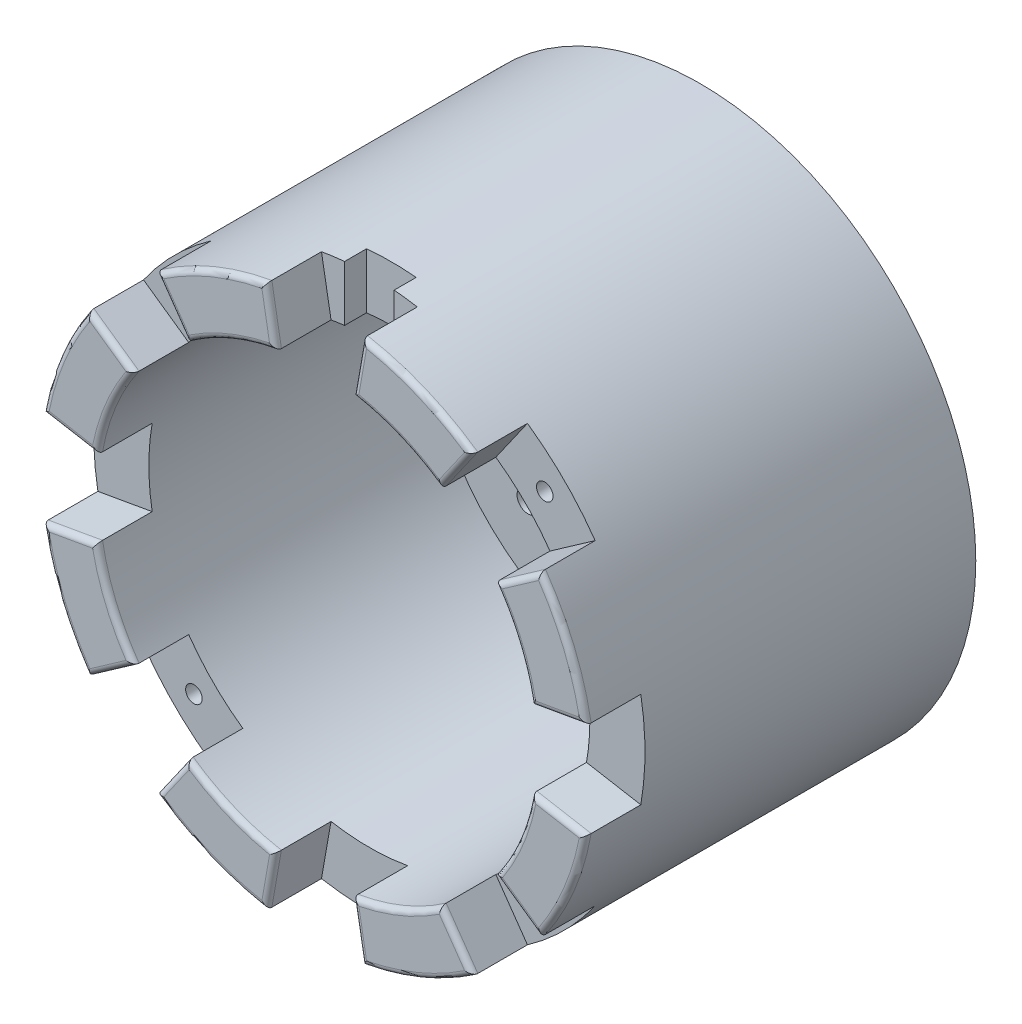
from build123d import *

# Parameters (mm, degrees)
CROQUIS1_R              = 50
CROQUIS1_R_2            = 18
SALIENTE_EXTRUIR1_DEPTH = 70
CROQUIS2_R              = 40
CORTAR_EXTRUIR1_DEPTH   = 50
CROQUIS4_R              = 40
CROQUIS4_W              = 5
CROQUIS4_H              = 10
CROQUIS4_W_2            = 10
CROQUIS4_H_2            = 5
CROQUIS4_R_2            = 18
CORTAR_EXTRUIR3_DEPTH   = 10
CROQUIS5_R              = 2
CORTAR_EXTRUIR4_DEPTH   = 93.736184955
CROQUIS6_R              = 5
CORTAR_EXTRUIR5_DEPTH   = 5
CORTAR_EXTRUIR6_DEPTH   = 10
REDONDEO2_R             = 1
CORTAR_EXTRUIR7_START   = -10
CROQUIS8_W              = 9
CROQUIS8_H              = 20
CORTAR_EXTRUIR7_DEPTH   = 4
CROQUIS9_R              = 1.5
CORTAR_EXTRUIR8_DEPTH   = 20


with BuildPart() as part:
    # Croquis1 → Saliente-Extruir1 (new body)
    with BuildSketch(Plane.XY):
        Circle(CROQUIS1_R)
        Circle(CROQUIS1_R_2, mode=Mode.SUBTRACT)
    extrude(amount=SALIENTE_EXTRUIR1_DEPTH)

    # Croquis2 → Cortar-Extruir1 (cut)
    with BuildSketch(Plane.XY.offset(70)):
        Circle(CROQUIS2_R)
    extrude(amount=-CORTAR_EXTRUIR1_DEPTH, mode=Mode.SUBTRACT)

    # Croquis4 → Cortar-Extruir3 (cut)
    with BuildSketch(Plane.XY.offset(20)):
        Circle(CROQUIS4_R)
        with Locations((0, 27.5)):
            Rectangle(CROQUIS4_W, CROQUIS4_H, mode=Mode.SUBTRACT)
        with Locations((27.5, 0)):
            Rectangle(CROQUIS4_W_2, CROQUIS4_H_2, mode=Mode.SUBTRACT)
        with Locations((0, -27.5)):
            Rectangle(CROQUIS4_W, CROQUIS4_H, mode=Mode.SUBTRACT)
        with Locations((-27.5, 0)):
            Rectangle(CROQUIS4_W_2, CROQUIS4_H_2, mode=Mode.SUBTRACT)
        Circle(CROQUIS4_R_2, mode=Mode.SUBTRACT)
    extrude(amount=-CORTAR_EXTRUIR3_DEPTH, mode=Mode.SUBTRACT)

    # Croquis5 → Cortar-Extruir4 (cut, through all)
    with BuildSketch(Plane.XY.offset(10)):
        with Locations((21.213203436, 21.213203436)):
            Circle(CROQUIS5_R)
        with Locations((21.213203436, -21.213203436)):
            Circle(CROQUIS5_R)
        with Locations((-21.213203436, -21.213203436)):
            Circle(CROQUIS5_R)
        with Locations((-21.213203436, 21.213203436)):
            Circle(CROQUIS5_R)
    extrude(amount=-CORTAR_EXTRUIR4_DEPTH, mode=Mode.SUBTRACT)

    # Croquis6 → Cortar-Extruir5 (cut)
    with BuildSketch(Plane(origin=(0, 0, 0), x_dir=(-1, 0, 0), z_dir=(0, 0, -1))):
        with Locations((-21.213203436, 21.213203436)):
            Circle(CROQUIS6_R)
        with Locations((21.486974797, 21.486974797)):
            Circle(CROQUIS6_R)
        with Locations((21.760746158, -21.213203436)):
            Circle(CROQUIS6_R)
        with Locations((-20.939432074, -21.486974797)):
            Circle(CROQUIS6_R)
    extrude(amount=-CORTAR_EXTRUIR5_DEPTH, mode=Mode.SUBTRACT)

    # Croquis7 → Cortar-Extruir6 (cut)
    with BuildSketch(Plane.XY.offset(70)):
        with BuildLine():
            ThreePointArc((-6.945927107, 39.39231012), (0, 40), (6.945927107, 39.39231012))
            Line((6.945927107, 39.39231012), (8.682408883, 49.240387651))
            ThreePointArc((8.682408883, 49.240387651), (0, 50), (-8.682408883, 49.240387651))
            Line((-8.682408883, 49.240387651), (-6.945927107, 39.39231012))
        make_face()
        with BuildLine():
            ThreePointArc((22.943057454, 32.766081772), (28.284271247, 28.284271247), (32.766081772, 22.943057454))
            Line((32.766081772, 22.943057454), (40.957602214, 28.678821818))
            ThreePointArc((40.957602214, 28.678821818), (35.355339059, 35.355339059), (28.678821818, 40.957602214))
            Line((28.678821818, 40.957602214), (22.943057454, 32.766081772))
        make_face()
        with BuildLine():
            ThreePointArc((39.39231012, 6.945927107), (40, 0), (39.39231012, -6.945927107))
            Line((39.39231012, -6.945927107), (49.240387651, -8.682408883))
            ThreePointArc((49.240387651, -8.682408883), (50, 0), (49.240387651, 8.682408883))
            Line((49.240387651, 8.682408883), (39.39231012, 6.945927107))
        make_face()
        with BuildLine():
            ThreePointArc((32.766081772, -22.943057454), (28.284271247, -28.284271247), (22.943057454, -32.766081772))
            Line((22.943057454, -32.766081772), (28.678821818, -40.957602214))
            ThreePointArc((28.678821818, -40.957602214), (35.355339059, -35.355339059), (40.957602214, -28.678821818))
            Line((40.957602214, -28.678821818), (32.766081772, -22.943057454))
        make_face()
        with BuildLine():
            ThreePointArc((6.945927107, -39.39231012), (0, -40), (-6.945927107, -39.39231012))
            Line((-6.945927107, -39.39231012), (-8.682408883, -49.240387651))
            ThreePointArc((-8.682408883, -49.240387651), (0, -50), (8.682408883, -49.240387651))
            Line((8.682408883, -49.240387651), (6.945927107, -39.39231012))
        make_face()
        with BuildLine():
            ThreePointArc((-22.943057454, -32.766081772), (-28.284271247, -28.284271247), (-32.766081772, -22.943057454))
            Line((-32.766081772, -22.943057454), (-40.957602214, -28.678821818))
            ThreePointArc((-40.957602214, -28.678821818), (-35.355339059, -35.355339059), (-28.678821818, -40.957602214))
            Line((-28.678821818, -40.957602214), (-22.943057454, -32.766081772))
        make_face()
        with BuildLine():
            ThreePointArc((-39.39231012, -6.945927107), (-40, 0), (-39.39231012, 6.945927107))
            Line((-39.39231012, 6.945927107), (-49.240387651, 8.682408883))
            ThreePointArc((-49.240387651, 8.682408883), (-50, 0), (-49.240387651, -8.682408883))
            Line((-49.240387651, -8.682408883), (-39.39231012, -6.945927107))
        make_face()
        with BuildLine():
            ThreePointArc((-32.766081772, 22.943057454), (-28.284271247, 28.284271247), (-22.943057454, 32.766081772))
            Line((-22.943057454, 32.766081772), (-28.678821818, 40.957602214))
            ThreePointArc((-28.678821818, 40.957602214), (-35.355339059, 35.355339059), (-40.957602214, 28.678821818))
            Line((-40.957602214, 28.678821818), (-32.766081772, 22.943057454))
        make_face()
    extrude(amount=-CORTAR_EXTRUIR6_DEPTH, mode=Mode.SUBTRACT)

    # Redondeo2
    redondeo2_edges = [part.edges().sort_by_distance(p)[0] for p in [
        (44.316348886, 7.814167995, 70),
        (44.316348886, -7.814167995, 70),
        (15.307337295, 36.9551813, 70),
        (-22.5, 0, 20),
        (15.307337295, -36.9551813, 70),
        (0, 22.5, 20),
        (-25.810939636, 36.861841993, 70),
        (2.5, 27.5, 20),
        (0, -22.5, 20),
        (-19.134171618, -46.193976626, 70),
        (-44.316348886, -7.814167995, 70),
        (27.5, -2.5, 20),
        (36.861841993, 25.810939636, 70),
        (25.810939636, -36.861841993, 70),
        (-19.134171618, 46.193976626, 70),
        (-15.307337295, 36.9551813, 70),
        (7.814167995, 44.316348886, 70),
        (19.134171618, -46.193976626, 70),
        (-2.5, -27.5, 20),
        (36.861841993, -25.810939636, 70),
        (0, 32.5, 20),
        (7.814167995, -44.316348886, 70),
        (-46.193976626, 19.134171618, 70),
        (-27.5, 2.5, 20),
        (-7.814167995, -44.316348886, 70),
        (32.5, 0, 20),
        (36.9551813, -15.307337295, 70),
        (-27.5, -2.5, 20),
        (-44.316348886, 7.814167995, 70),
        (-36.9551813, 15.307337295, 70),
        (46.193976626, -19.134171618, 70),
        (-7.814167995, 44.316348886, 70),
        (22.5, 0, 20),
        (-46.193976626, -19.134171618, 70),
        (2.5, -27.5, 20),
        (19.134171618, 46.193976626, 70),
        (27.5, 2.5, 20),
        (36.9551813, 15.307337295, 70),
        (-15.307337295, -36.9551813, 70),
        (-36.861841993, -25.810939636, 70),
        (46.193976626, 19.134171618, 70),
        (0, -32.5, 20),
        (-36.9551813, -15.307337295, 70),
        (-36.861841993, 25.810939636, 70),
        (-2.5, 27.5, 20),
        (25.810939636, 36.861841993, 70),
        (-25.810939636, -36.861841993, 70),
        (-32.5, 0, 20),
    ]]
    fillet(redondeo2_edges, radius=REDONDEO2_R)

    # Croquis8 → Cortar-Extruir7 (cut)
    with BuildSketch(Plane.XY.offset(70).offset(CORTAR_EXTRUIR7_START)):
        with Locations((0, 45)):
            Rectangle(CROQUIS8_W, CROQUIS8_H)
    extrude(amount=-CORTAR_EXTRUIR7_DEPTH, mode=Mode.SUBTRACT)

    # Croquis9 → Cortar-Extruir8 (cut)
    with BuildSketch(Plane.XY.offset(60)):
        with Locations((31.819805153, 31.819805153)):
            Circle(CROQUIS9_R)
        with Locations((31.819805153, -31.819805153)):
            Circle(CROQUIS9_R)
        with Locations((-31.819805153, -31.819805153)):
            Circle(CROQUIS9_R)
        with Locations((-31.819805153, 31.819805153)):
            Circle(CROQUIS9_R)
    extrude(amount=-CORTAR_EXTRUIR8_DEPTH, mode=Mode.SUBTRACT)


solid = part.part
